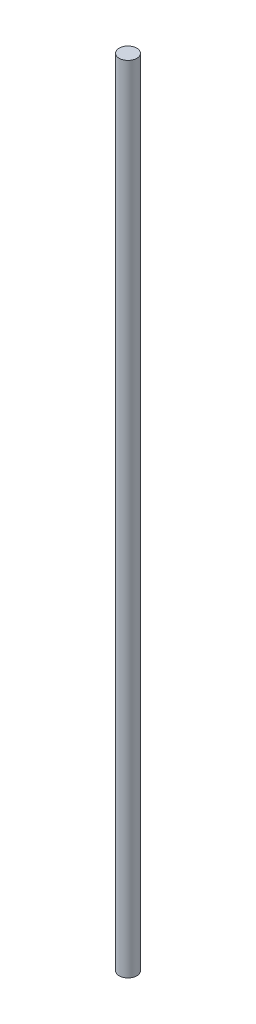
from build123d import *

# Parameters (mm, degrees)
SKETCH1_R           = 5
BOSS_EXTRUDE1_DEPTH = 450


with BuildPart() as part:
    # Sketch1 → Boss-Extrude1 (new body)
    with BuildSketch(Plane(origin=(0, 0, 0), x_dir=(1, 0, 0), z_dir=(0, 1, 0))):
        with Locations(Location((0, 0, 0), (0, 0, 270))):
            Circle(SKETCH1_R)
    extrude(amount=BOSS_EXTRUDE1_DEPTH)


solid = part.part
